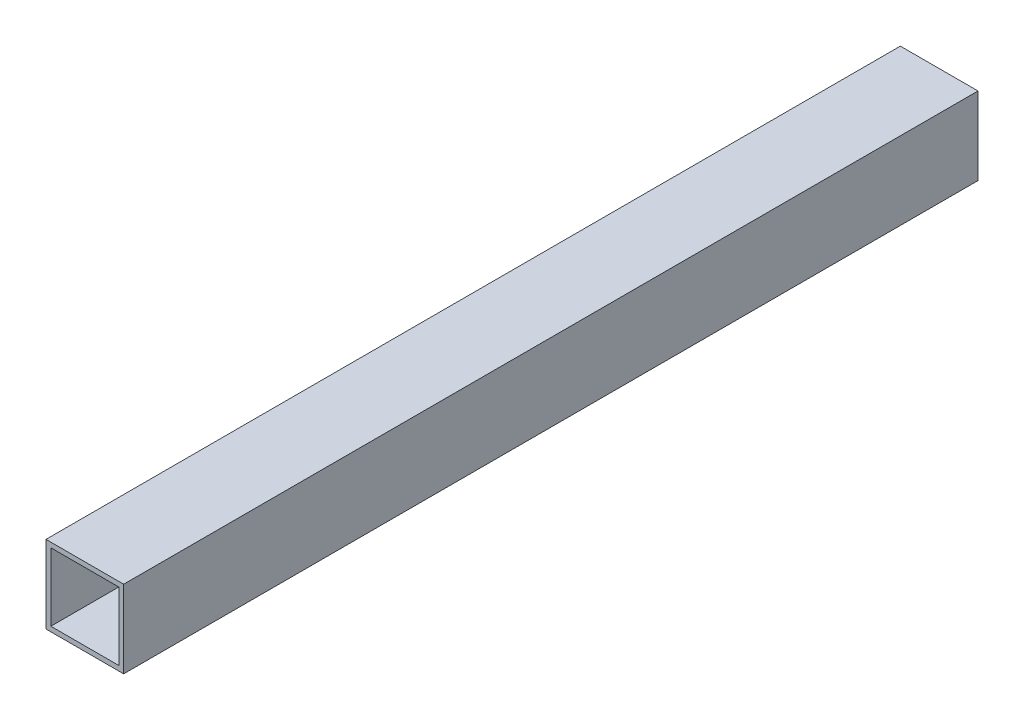
from build123d import *

# Parameters (mm, degrees)
SKETCH1_W           = 25.4
SKETCH1_H           = 25.4
SKETCH1_W_2         = 22.225
SKETCH1_H_2         = 22.225
BOSS_EXTRUDE1_DEPTH = 139.7


with BuildPart() as part:
    # Sketch1 → Boss-Extrude1 (new, symmetric)
    with BuildSketch(Plane.XY):
        Rectangle(SKETCH1_W, SKETCH1_H)
        Rectangle(SKETCH1_W_2, SKETCH1_H_2, mode=Mode.SUBTRACT)
    extrude(amount=BOSS_EXTRUDE1_DEPTH, both=True)


solid = part.part
